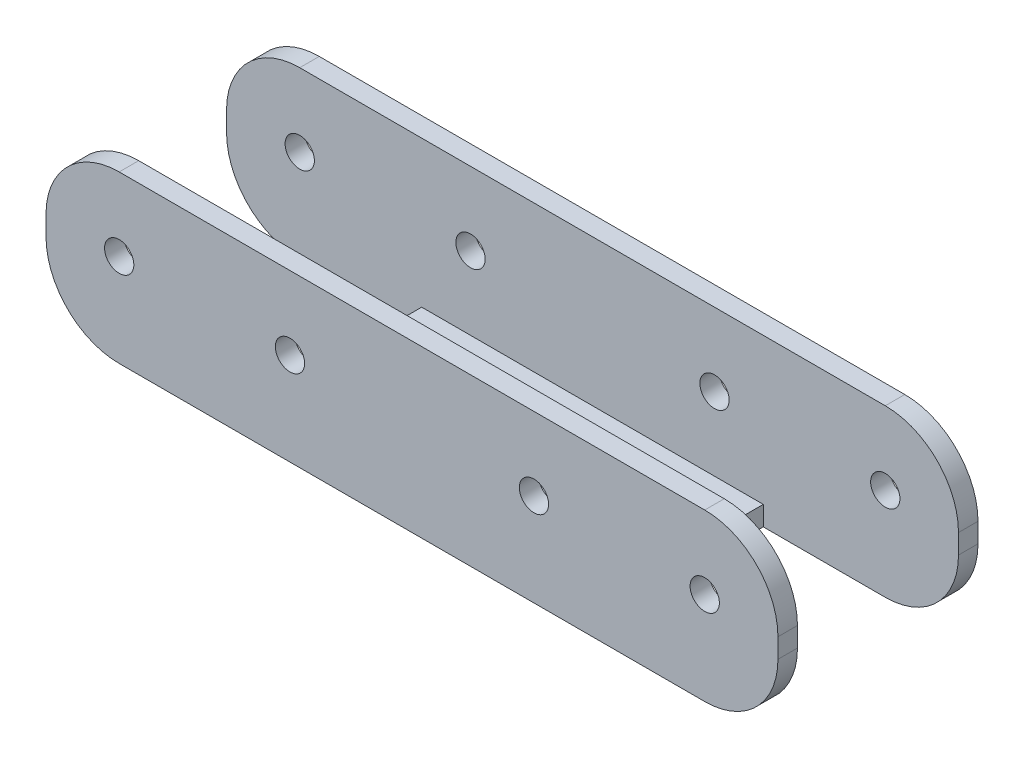
from build123d import *

# Parameters (mm, degrees)
EXTRUDE_1_DEPTH     = 150
SKETCH_2_R          = 3
CUT_EXTRUDE_1_DEPTH = 300
SKETCH_3_W          = 40
SKETCH_3_H          = 33
CUT_EXTRUDE_2_DEPTH = 10
FILLET_1_R          = 15
SKETCH_4_R          = 3
CUT_EXTRUDE_3_DEPTH = 160.176003217


with BuildPart() as part:
    # 草图1 → 凸台-拉伸1 (new body)
    with BuildSketch(Plane(origin=(0, 0, 0), x_dir=(0, 0, -1), z_dir=(1, 0, 0))):
        Polygon((-16.5, 4), (-16.5, 34), (-20.5, 34), (-20.5, 0), (0, 0), (0, 4), align=None)
        Polygon((16.5, 4), (0, 4), (0, 0), (20.5, 0), (20.5, 34), (16.5, 34), align=None)
    extrude(amount=EXTRUDE_1_DEPTH)

    # 草图2 → 切除-拉伸1 (cut)
    with BuildSketch(Plane.XY.offset(20.5)):
        with Locations(Location((15, 19, 0), (0, 0, 90))):
            Circle(SKETCH_2_R)
        with Locations(Location((135, 19, 0), (0, 0, 90))):
            Circle(SKETCH_2_R)
    extrude(amount=-CUT_EXTRUDE_1_DEPTH, mode=Mode.SUBTRACT)

    # 草图3 → 切除-拉伸2 (cut)
    with BuildSketch(Plane.XZ):
        with Locations((130, 0)):
            Rectangle(SKETCH_3_W, SKETCH_3_H)
        with Locations((20, 0)):
            Rectangle(SKETCH_3_W, SKETCH_3_H)
    extrude(amount=-CUT_EXTRUDE_2_DEPTH, mode=Mode.SUBTRACT)

    # 圆角1
    fillet_1_edges = [part.edges().sort_by_distance(p)[0] for p in [
        (0, 0, 18.5),
        (0, 34, 18.5),
        (150, 34, 18.5),
        (150, 0, 18.5),
        (150, 34, -18.5),
        (150, 0, -18.5),
        (0, 0, -18.5),
        (0, 34, -18.5),
    ]]
    fillet(fillet_1_edges, radius=FILLET_1_R)

    # 草图4 → 切除-拉伸3 (cut, through all)
    with BuildSketch(Plane.XY.offset(20.5)):
        with Locations((50, 19)):
            Circle(SKETCH_4_R)
        with Locations((100, 19)):
            Circle(SKETCH_4_R)
    extrude(amount=-CUT_EXTRUDE_3_DEPTH, mode=Mode.SUBTRACT)


solid = part.part
